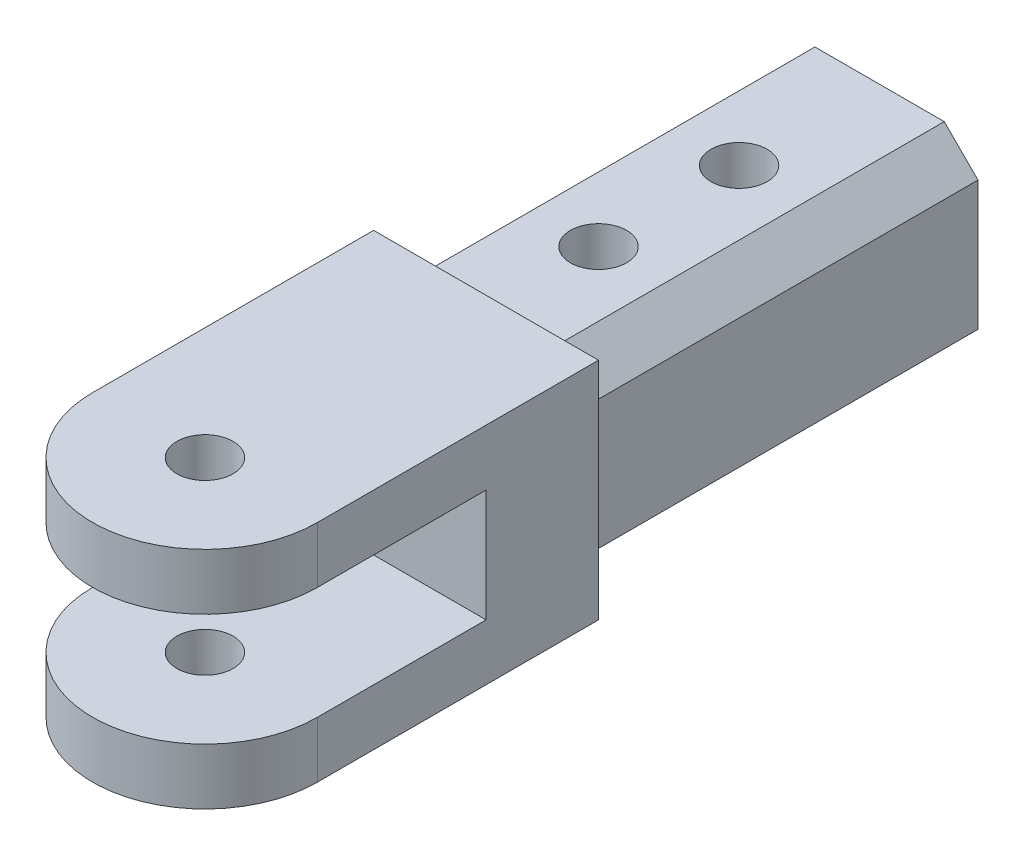
from build123d import *

# Parameters (mm, degrees)
SKETCH1_W           = 22.225
SKETCH1_H           = 22.225
BOSS_EXTRUDE1_DEPTH = 44.45
CHAMFER1_SIZE       = 3.81
SKETCH2_W           = 25.4
SKETCH2_H           = 25.4
BOSS_EXTRUDE2_DEPTH = 44.45
SKETCH3_W           = 25.4
SKETCH3_H           = 12.7
CUT_EXTRUDE1_DEPTH  = 31.75
SKETCH4_R           = 3.175
CUT_EXTRUDE2_DEPTH  = 94.3255592
SKETCH5_R           = 3.175
CUT_EXTRUDE3_DEPTH  = 22.225


with BuildPart() as part:
    # Sketch1 → Boss-Extrude1 (new body)
    with BuildSketch(Plane.XY):
        Rectangle(SKETCH1_W, SKETCH1_H)
    extrude(amount=BOSS_EXTRUDE1_DEPTH)

    # Chamfer1
    chamfer1_edges = [part.edges().sort_by_distance(p)[0] for p in [
        (11.1125, -11.1125, 22.225),
        (-11.1125, -11.1125, 22.225),
        (-11.1125, 11.1125, 22.225),
        (11.1125, 11.1125, 22.225),
    ]]
    chamfer(chamfer1_edges, length=CHAMFER1_SIZE)

    # Sketch2 → Boss-Extrude2 (add)
    with BuildSketch(Plane.XY.offset(44.45)):
        Rectangle(SKETCH2_W, SKETCH2_H)
    extrude(amount=BOSS_EXTRUDE2_DEPTH)

    # Sketch3 → Cut-Extrude1 (cut)
    with BuildSketch(Plane.XY.offset(88.9)):
        Rectangle(SKETCH3_W, SKETCH3_H)
    extrude(amount=-CUT_EXTRUDE1_DEPTH, mode=Mode.SUBTRACT)

    # Sketch4 → Cut-Extrude2 (cut, through all)
    with BuildSketch(Plane(origin=(0, 12.7, 0), x_dir=(1, 0, 0), z_dir=(0, 1, 0))):
        with Locations(Location((0, -76.2, 0), (0, 0, 270))):
            Circle(SKETCH4_R)
        with BuildLine():
            Line((-12.7, -76.2), (-12.7, -95.25))
            Line((-12.7, -95.25), (12.7, -95.25))
            Line((12.7, -95.25), (12.7, -76.2))
            ThreePointArc((12.7, -76.2), (0, -88.9), (-12.7, -76.2))
        make_face()
    extrude(amount=-CUT_EXTRUDE2_DEPTH, mode=Mode.SUBTRACT)

    # Sketch5 → Cut-Extrude3 (cut)
    with BuildSketch(Plane(origin=(0, 11.1125, 0), x_dir=(1, 0, 0), z_dir=(0, 1, 0))):
        with Locations(Location((0, -31.75, 0), (0, 0, 270))):
            Circle(SKETCH5_R)
        with Locations(Location((0, -15.875, 0), (0, 0, 270))):
            Circle(SKETCH5_R)
    extrude(amount=-CUT_EXTRUDE3_DEPTH, mode=Mode.SUBTRACT)


solid = part.part
